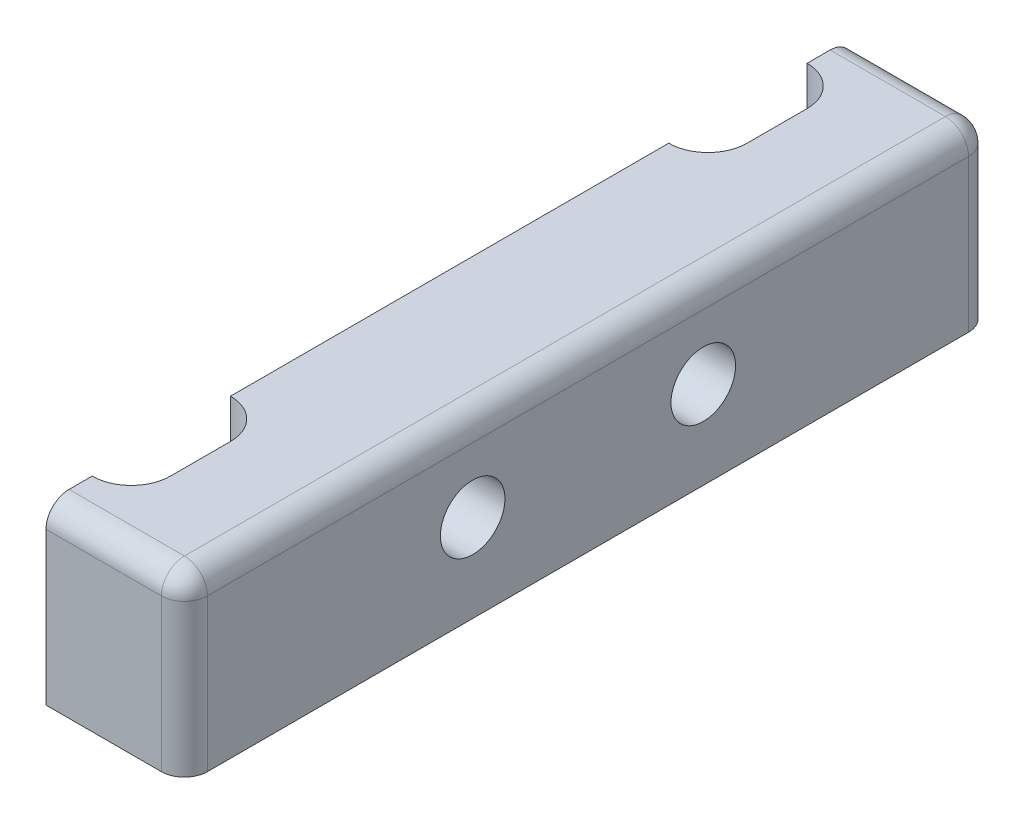
from build123d import *

# Parameters (mm, degrees)
BASE_DEPTH           = 7.6
SKETCH2_R            = 1.4
SCREW_HOLES_DEPTH    = 21.000249998
F_1MM_EDGE_FILLETS_R = 1


with BuildPart() as part:
    # Sketch1 → Base (new body)
    with BuildSketch(Plane(origin=(0, 0, 0), x_dir=(1, 0, 0), z_dir=(0, 1, 0))):
        with BuildLine():
            Line((-6, 17.5), (-6, 15.5))
            ThreePointArc((-6, 15.5), (-4.797918472, 15.002081528), (-4.3, 13.8))
            Line((-4.3, 13.8), (-4.3, 11.2))
            ThreePointArc((-4.3, 11.2), (-4.797918472, 9.997918472), (-6, 9.5))
            Line((-6, 9.5), (-6, -9.5))
            ThreePointArc((-6, -9.5), (-4.797918472, -9.997918472), (-4.3, -11.2))
            Line((-4.3, -11.2), (-4.3, -13.8))
            ThreePointArc((-4.3, -13.8), (-4.797918472, -15.002081528), (-6, -15.5))
            Line((-6, -15.5), (-6, -17.5))
            Line((-6, -17.5), (0, -17.5))
            Line((0, -17.5), (0, 17.5))
            Line((0, 17.5), (-6, 17.5))
        make_face()
    extrude(amount=BASE_DEPTH)

    # Sketch2 → Screw Holes (cut, through all)
    with BuildSketch(Plane.ZY.offset(6)):
        with Locations((-5, 3.8)):
            Circle(SKETCH2_R)
        with Locations(Location((5, 3.8, 0), (0, 0, 180))):
            Circle(SKETCH2_R)
    extrude(amount=-SCREW_HOLES_DEPTH, mode=Mode.SUBTRACT)

    # 1mm Edge Fillets
    f_1mm_edge_fillets_edges = [part.edges().sort_by_distance(p)[0] for p in [
        (0, 3.8, -17.5),
        (0, 3.8, 17.5),
        (-3, 7.6, 17.5),
        (0, 7.6, 0),
        (-3, 7.6, -17.5),
    ]]
    fillet(f_1mm_edge_fillets_edges, radius=F_1MM_EDGE_FILLETS_R)


solid = part.part
